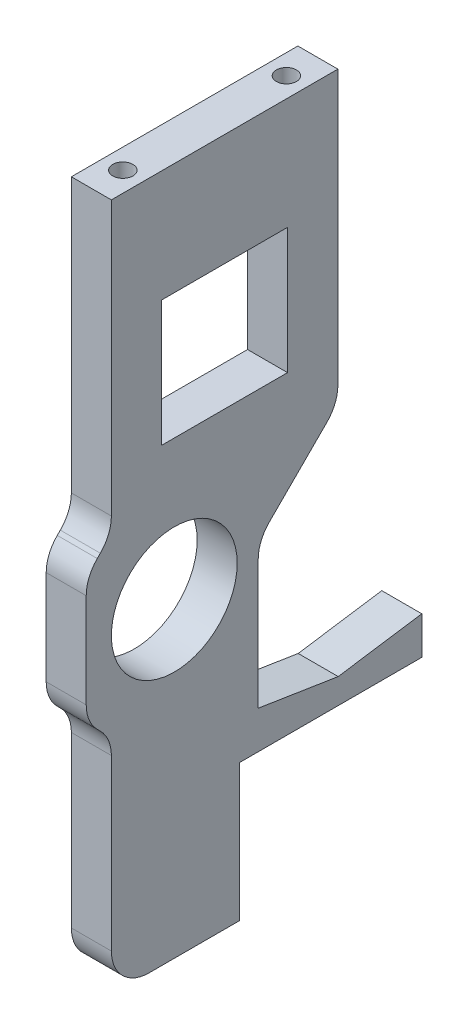
from build123d import *

# Parameters (mm, degrees)
BOSS_EXTRUDE1_DEPTH       = 3.18
SKETCH2_4_OUTSIDE_W       = 40.858
SKETCH2_4_OUTSIDE_H       = 68.888
SKETCH2_4_OUTSIDE_R       = 5
CUT_EXTRUDE2_DEPTH        = 3.18
FILLET6_R                 = 3
M2X0_4_TAPPED_HOLE1_D     = 1.6
M2X0_4_TAPPED_HOLE1_DEPTH = 5.519311505
M2X0_4_TAPPED_HOLE1_TIP   = 0.480688495
SKETCH10_W                = 10
SKETCH10_H                = 10
CUT_EXTRUDE4_DEPTH        = 10


with BuildPart() as part:
    # Sketch2 → Boss-Extrude1 (new body)
    with BuildSketch(Plane(origin=(0, 0, 0), x_dir=(0, 0, -1), z_dir=(1, 0, 0))):
        Polygon((-7.39959254, 19.413571875), (10.60040746, 19.413571875), (10.60040746, -3.586428125), (4.27040746, -9.916428125), (4.27040746, -21.406428125), (10.625315102, -22.406428125), (17.27040746, -21.406428125), (17.27040746, -24.406428125), (2.77040746, -24.406428125), (2.77040746, -35.286428125), (-7.39959254, -35.286428125), (-7.39959254, -17.586428125), (-9.39959254, -15.586428125), (-9.39959254, -5.586428125), (-7.39959254, -3.586428125), align=None)
    extrude(amount=-BOSS_EXTRUDE1_DEPTH)

    # Sketch2<4> outside → Cut-Extrude2 (cut)
    # profile 1 of 3: a face of its own
    with BuildSketch(Plane(origin=(0, 0, 0), x_dir=(0, 0, -1), z_dir=(1, 0, 0))):
        with Locations((3.935, -7.936)):
            Rectangle(SKETCH2_4_OUTSIDE_W, SKETCH2_4_OUTSIDE_H)
        Polygon((-7.39959254, 19.413571875), (10.60040746, 19.413571875), (10.60040746, -3.586428125), (4.27040746, -9.916428125), (4.27040746, -21.406428125), (10.625315102, -22.406428125), (17.27040746, -21.406428125), (17.27040746, -24.406428125), (2.77040746, -24.406428125), (2.77040746, -35.286428125), (-7.39959254, -35.286428125), (-7.39959254, -17.586428125), (-9.39959254, -15.586428125), (-9.39959254, -5.586428125), (-7.39959254, -3.586428125), align=None, mode=Mode.SUBTRACT)
    # profile 2 of 3: a face of its own
    with BuildSketch(Plane(origin=(0, 0, 0), x_dir=(0, 0, -1), z_dir=(1, 0, 0))):
        with Locations((-2.39959254, -10.586428125)):
            Circle(SKETCH2_4_OUTSIDE_R)
    # profile 3 of 3: a face of its own
    with BuildSketch(Plane(origin=(0, 0, 0), x_dir=(0, 0, -1), z_dir=(1, 0, 0))):
        with Locations((1.60040746, 5.524437773)):
            Circle(SKETCH2_4_OUTSIDE_R)
    extrude(amount=-CUT_EXTRUDE2_DEPTH, mode=Mode.SUBTRACT)

    # Fillet6
    fillet6_edges = [part.edges().sort_by_distance(p)[0] for p in [
        (-1.59, -17.586428125, 7.39959254),
        (-1.59, -15.586428125, 9.39959254),
        (-1.59, -5.586428125, 9.39959254),
        (-1.59, -3.586428125, 7.39959254),
        (-1.59, -35.286428125, 7.39959254),
        (-1.59, -3.586428125, -10.60040746),
        (-1.59, -9.916428125, -4.27040746),
    ]]
    fillet(fillet6_edges, radius=FILLET6_R)

    # M2x0.4 Tapped Hole1
    with Locations(Plane(origin=(0, 19.413571875, 0), x_dir=(1, 0, 0), z_dir=(0, 1, 0))):
        with Locations((-1.59, 8.10040746), (-1.59, -4.89959254)):
            Hole(M2X0_4_TAPPED_HOLE1_D / 2, depth=M2X0_4_TAPPED_HOLE1_DEPTH)
            with Locations((0, 0, -(M2X0_4_TAPPED_HOLE1_DEPTH + M2X0_4_TAPPED_HOLE1_TIP / 2))):  # 118° drill point
                Cone(0, M2X0_4_TAPPED_HOLE1_D / 2, M2X0_4_TAPPED_HOLE1_TIP, mode=Mode.SUBTRACT)


with BuildPart() as body_2:
    # Mirror1: mirrored copy
    add(part.part.mirror(Plane.ZY))

    # Sketch10 → Cut-Extrude4 (cut)
    with BuildSketch(Plane(origin=(3.18, 0, 0), x_dir=(0, 0, -1), z_dir=(1, 0, 0))):
        with Locations((1.60040746, 5.524437773)):
            Rectangle(SKETCH10_W, SKETCH10_H)
    extrude(amount=-CUT_EXTRUDE4_DEPTH, mode=Mode.SUBTRACT)


solid = body_2.part
